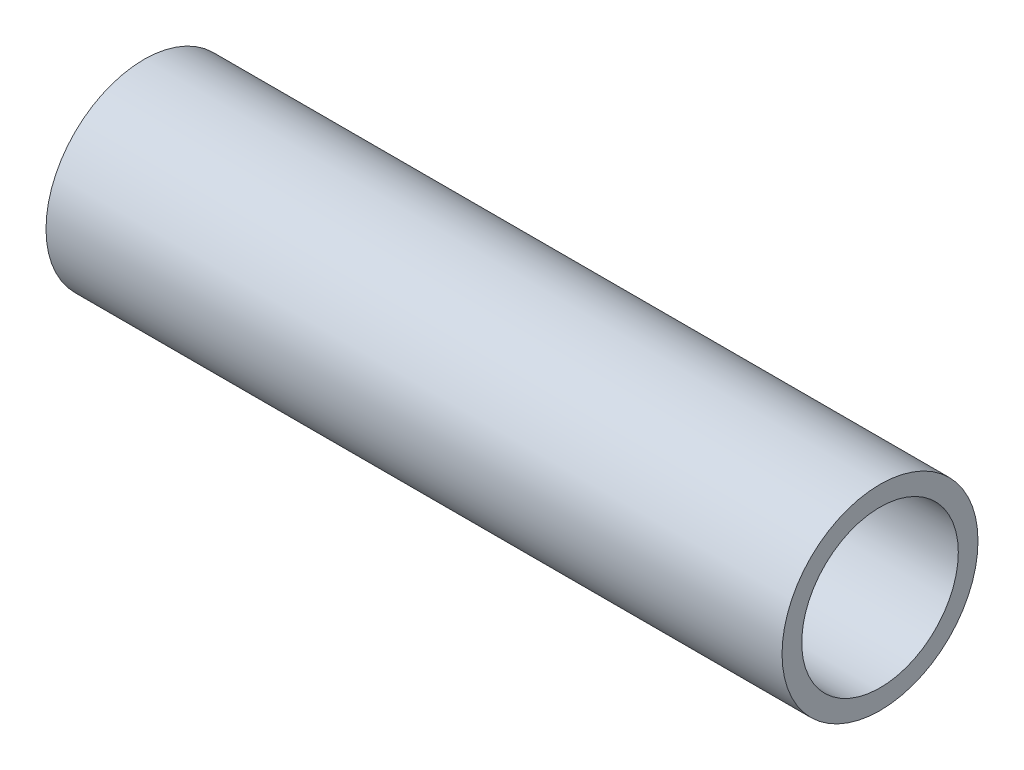
from build123d import *

# Parameters (mm, degrees)
CROQUIS1_R              = 10.65
CROQUIS1_R_2            = 8.51
SALIENTE_EXTRUIR1_DEPTH = 80


with BuildPart() as part:
    # Croquis1 → Saliente-Extruir1 (new body)
    with BuildSketch(Plane(origin=(0, 0, 0), x_dir=(0, 0, -1), z_dir=(1, 0, 0))):
        Circle(CROQUIS1_R)
        Circle(CROQUIS1_R_2, mode=Mode.SUBTRACT)
    extrude(amount=SALIENTE_EXTRUIR1_DEPTH)


solid = part.part
